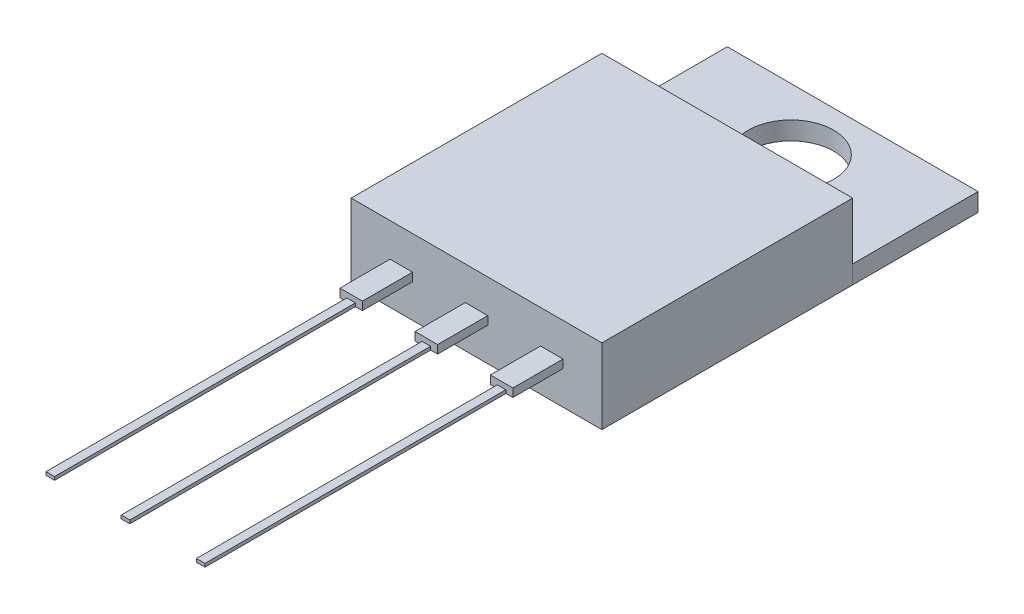
from build123d import *

# Parameters (mm, degrees)
SKETCH1_W             = 10
SKETCH1_H             = 10
BOSS_EXTRUDE1_DEPTH   = 3
SKETCH2_W             = 10
SKETCH2_H             = 0.72584538
BOSS_EXTRUDE2_DEPTH   = 5
SKETCH3_W             = 0.89695156
SKETCH3_H             = 0.331017838
BOSS_EXTRUDE3_DEPTH   = 2
BOSS_EXTRUDE3_2_DEPTH = 2
BOSS_EXTRUDE3_3_DEPTH = 2
SKETCH4_W             = 0.341066666
SKETCH4_H             = 0.131155903
BOSS_EXTRUDE4_DEPTH   = 12
BOSS_EXTRUDE4_2_DEPTH = 12
BOSS_EXTRUDE4_3_DEPTH = 12
SKETCH5_R             = 1.702796859
CUT_EXTRUDE1_DEPTH    = 12


with BuildPart() as part:
    # Sketch1 → Boss-Extrude1 (new body)
    with BuildSketch(Plane(origin=(0, 0, 0), x_dir=(1, 0, 0), z_dir=(0, 1, 0))):
        Rectangle(SKETCH1_W, SKETCH1_H)
    extrude(amount=BOSS_EXTRUDE1_DEPTH)


with BuildPart() as body_2:
    # Sketch2 → Boss-Extrude2 (new body)
    with BuildSketch(Plane(origin=(0, 0, -5), x_dir=(-1, 0, 0), z_dir=(0, 0, -1))):
        with Locations((0, 0.36292269)):
            Rectangle(SKETCH2_W, SKETCH2_H)
    extrude(amount=BOSS_EXTRUDE2_DEPTH)

    # Sketch5 → Cut-Extrude1 (cut)
    with BuildSketch(Plane(origin=(0, 0.72584538, 0), x_dir=(1, 0, 0), z_dir=(0, 1, 0))):
        with Locations(Location((0, 7.540381198, 0), (0, 0, 270))):
            Circle(SKETCH5_R)
    extrude(amount=-CUT_EXTRUDE1_DEPTH, mode=Mode.SUBTRACT)


with BuildPart() as body_3:
    # Sketch3 → Boss-Extrude3 (new body)
    with BuildSketch(Plane.XY.offset(5)):
        with Locations((3, 1.5)):
            Rectangle(SKETCH3_W, SKETCH3_H)
    extrude(amount=BOSS_EXTRUDE3_DEPTH)


with BuildPart() as body_4:
    # Sketch3 → Boss-Extrude3 2 (new body)
    with BuildSketch(Plane.XY.offset(5)):
        with Locations((0, 1.5)):
            Rectangle(SKETCH3_W, SKETCH3_H)
    extrude(amount=BOSS_EXTRUDE3_2_DEPTH)


with BuildPart() as body_5:
    # Sketch3 → Boss-Extrude3 3 (new body)
    with BuildSketch(Plane.XY.offset(5)):
        with Locations((-3, 1.5)):
            Rectangle(SKETCH3_W, SKETCH3_H)
    extrude(amount=BOSS_EXTRUDE3_3_DEPTH)


with BuildPart() as body_6:
    # Sketch4 → Boss-Extrude4 (new body)
    with BuildSketch(Plane.XY.offset(7)):
        with Locations((-3, 1.400069033)):
            Rectangle(SKETCH4_W, SKETCH4_H)
    extrude(amount=BOSS_EXTRUDE4_DEPTH)


with BuildPart() as body_7:
    # Sketch4 → Boss-Extrude4 2 (new body)
    with BuildSketch(Plane.XY.offset(7)):
        with Locations((0, 1.400069033)):
            Rectangle(SKETCH4_W, SKETCH4_H)
    extrude(amount=BOSS_EXTRUDE4_2_DEPTH)


with BuildPart() as body_8:
    # Sketch4 → Boss-Extrude4 3 (new body)
    with BuildSketch(Plane.XY.offset(7)):
        with Locations((3, 1.400069033)):
            Rectangle(SKETCH4_W, SKETCH4_H)
    extrude(amount=BOSS_EXTRUDE4_3_DEPTH)


solid = Compound([part.part, body_2.part, body_3.part, body_4.part, body_5.part, body_6.part, body_7.part, body_8.part])
